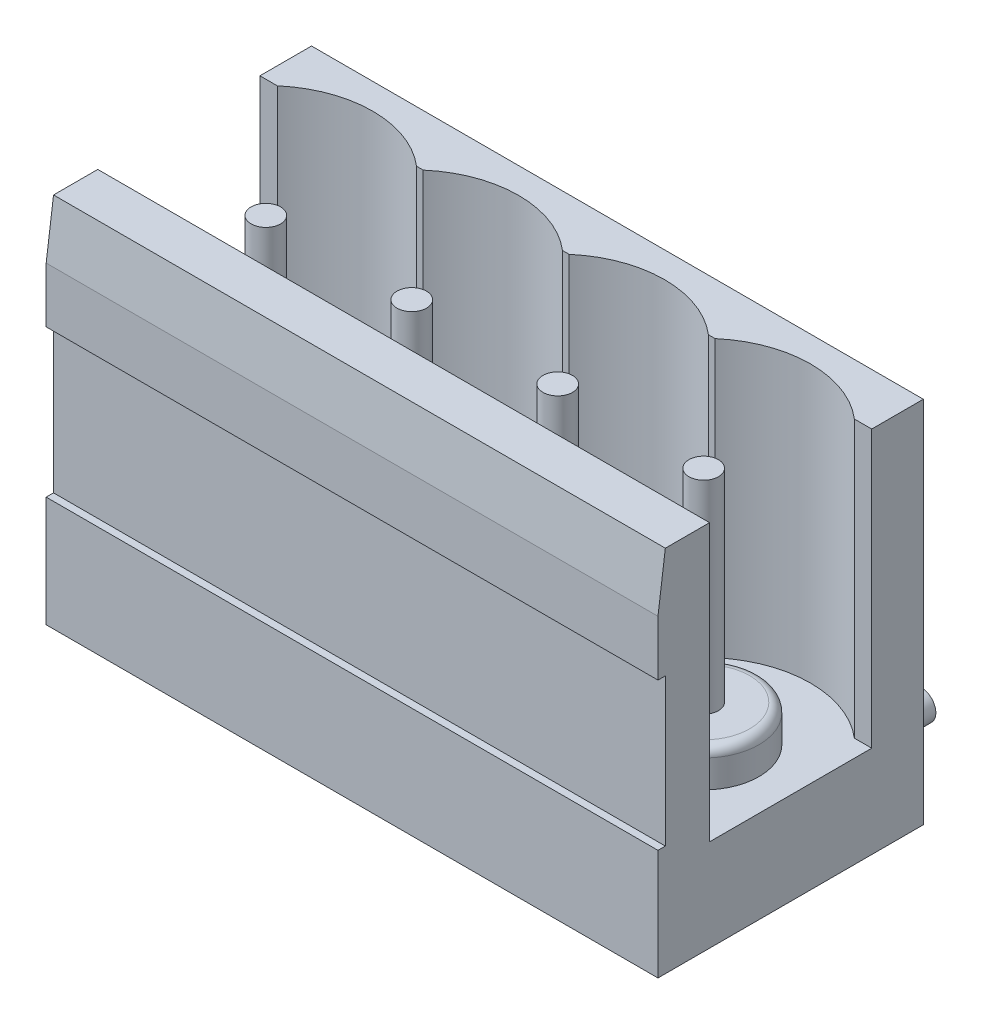
from build123d import *

# Parameters (mm, degrees)
SKETCH_1_W          = 16.6
SKETCH_1_H          = 10
EXTRUDE_1_DEPTH     = 7.2
SKETCH_2_W          = 1.17709233
SKETCH_2_H          = 4
CUT_EXTRUDE_1_DEPTH = 21.673654733
CUT_EXTRUDE_2_DEPTH = 21.673654733
CUT_EXTRUDE_4_DEPTH = 7.5
SKETCH_12_R         = 0.4
EXTRUDE_8_DEPTH     = 6.5
SKETCH_13_R         = 1.5
EXTRUDE_9_DEPTH     = 1
FILLET_2_R          = 0.25
SKETCH_14_W         = 1
SKETCH_14_H         = 4.2
CUT_EXTRUDE_7_DEPTH = 1
SKETCH_15_R         = 0.4
EXTRUDE_10_DEPTH    = 6.5
CUT_EXTRUDE_9_DEPTH = 7.5


with BuildPart() as part:
    # 草图1 → 凸台-拉伸1 (new body)
    with BuildSketch(Plane.XY):
        with Locations((8.3, 5)):
            Rectangle(SKETCH_1_W, SKETCH_1_H)
    extrude(amount=EXTRUDE_1_DEPTH)

    # 草图2 → 切除-拉伸1 (cut, through all)
    with BuildSketch(Plane(origin=(16.6, 0, 0), x_dir=(0, 0, -1), z_dir=(1, 0, 0))):
        with Locations((-7.588546165, 5)):
            Rectangle(SKETCH_2_W, SKETCH_2_H)
    extrude(amount=-CUT_EXTRUDE_1_DEPTH, mode=Mode.SUBTRACT)

    # 草图3 → 切除-拉伸2 (cut, through all)
    with BuildSketch(Plane(origin=(16.6, 0, 0), x_dir=(0, 0, -1), z_dir=(1, 0, 0))):
        Polygon((-7, 10), (-7.2, 8.5), (-7.2, 10), align=None)
    extrude(amount=-CUT_EXTRUDE_2_DEPTH, mode=Mode.SUBTRACT)

    # 草图6 → 切除-拉伸4 (cut)
    with BuildSketch(Plane(origin=(0, 10, 0), x_dir=(1, 0, 0), z_dir=(0, 1, 0))):
        Polygon((0.5, -1.4), (0.391822444, -1.4), (0, -1.4), (0, -5.8), (0.391822444, -5.8), (0.5, -5.8), (16.6, -5.8), (16.6, -1.4), align=None)
    extrude(amount=-CUT_EXTRUDE_4_DEPTH, mode=Mode.SUBTRACT)

    # 草图12 → 凸台-拉伸8 (add)
    with BuildSketch(Plane(origin=(0, 2.5, 0), x_dir=(1, 0, 0), z_dir=(0, 1, 0))):
        with Locations(Location((6.32, -3.6, 0), (0, 0, 270))):
            Circle(SKETCH_12_R)
        with Locations(Location((2.36, -3.6, 0), (0, 0, 270))):
            Circle(SKETCH_12_R)
        with Locations(Location((14.24, -3.6, 0), (0, 0, 90))):
            Circle(SKETCH_12_R)
        with Locations(Location((10.28, -3.6, 0), (0, 0, 90))):
            Circle(SKETCH_12_R)
    extrude(amount=EXTRUDE_8_DEPTH)

    # 草图13 → 凸台-拉伸9 (add)
    with BuildSketch(Plane(origin=(0, 2.5, 0), x_dir=(1, 0, 0), z_dir=(0, 1, 0))):
        with Locations(Location((14.24, -3.6, 0), (0, 0, 270))):
            Circle(SKETCH_13_R)
        with Locations(Location((10.28, -3.6, 0), (0, 0, 270))):
            Circle(SKETCH_13_R)
        with Locations(Location((6.32, -3.6, 0), (0, 0, 270))):
            Circle(SKETCH_13_R)
        with Locations(Location((2.36, -3.6, 0), (0, 0, 270))):
            Circle(SKETCH_13_R)
    extrude(amount=EXTRUDE_9_DEPTH)

    # 圆角2
    fillet_2_edges = [part.edges().sort_by_distance(p)[0] for p in [
        (14.24, 3.5, 2.1),
        (10.28, 3.5, 2.1),
        (6.32, 3.5, 2.1),
        (2.36, 3.5, 2.1),
    ]]
    fillet(fillet_2_edges, radius=FILLET_2_R)

    # 草图14 → 切除-拉伸7 (cut)
    with BuildSketch(Plane.XZ):
        with Locations((2.36, 2.1)):
            Rectangle(SKETCH_14_W, SKETCH_14_H)
        with Locations((6.32, 2.1)):
            Rectangle(SKETCH_14_W, SKETCH_14_H)
        with Locations((10.28, 2.1)):
            Rectangle(SKETCH_14_W, SKETCH_14_H)
        with Locations((14.24, 2.1)):
            Rectangle(SKETCH_14_W, SKETCH_14_H)
    extrude(amount=-CUT_EXTRUDE_7_DEPTH, mode=Mode.SUBTRACT)

    # 草图15 → 凸台-拉伸10 (add)
    with BuildSketch(Plane(origin=(0, 0, 4.2), x_dir=(-1, 0, 0), z_dir=(0, 0, -1))):
        with Locations(Location((-2.36, 0.5, 0), (0, 0, 180))):
            Circle(SKETCH_15_R)
        with Locations(Location((-6.32, 0.5, 0), (0, 0, 180))):
            Circle(SKETCH_15_R)
        with Locations((-10.28, 0.5)):
            Circle(SKETCH_15_R)
        with Locations((-14.24, 0.5)):
            Circle(SKETCH_15_R)
    extrude(amount=EXTRUDE_10_DEPTH)

    # 草图16 → 切除-拉伸9 (cut)
    with BuildSketch(Plane(origin=(0, 10, 0), x_dir=(1, 0, 0), z_dir=(0, 1, 0))):
        with BuildLine():
            Line((0.470555637, -1.4), (4.249444363, -1.4))
            ThreePointArc((4.249444363, -1.4), (2.36, -0.7), (0.470555637, -1.4))
        make_face()
        with BuildLine():
            Line((12.350555637, -1.4), (16.129444363, -1.4))
            ThreePointArc((16.129444363, -1.4), (14.24, -0.7), (12.350555637, -1.4))
        make_face()
        with BuildLine():
            Line((8.390555637, -1.4), (12.169444363, -1.4))
            ThreePointArc((12.169444363, -1.4), (10.28, -0.7), (8.390555637, -1.4))
        make_face()
        with BuildLine():
            Line((4.430555637, -1.4), (8.209444363, -1.4))
            ThreePointArc((8.209444363, -1.4), (6.32, -0.7), (4.430555637, -1.4))
        make_face()
    extrude(amount=-CUT_EXTRUDE_9_DEPTH, mode=Mode.SUBTRACT)


solid = part.part
